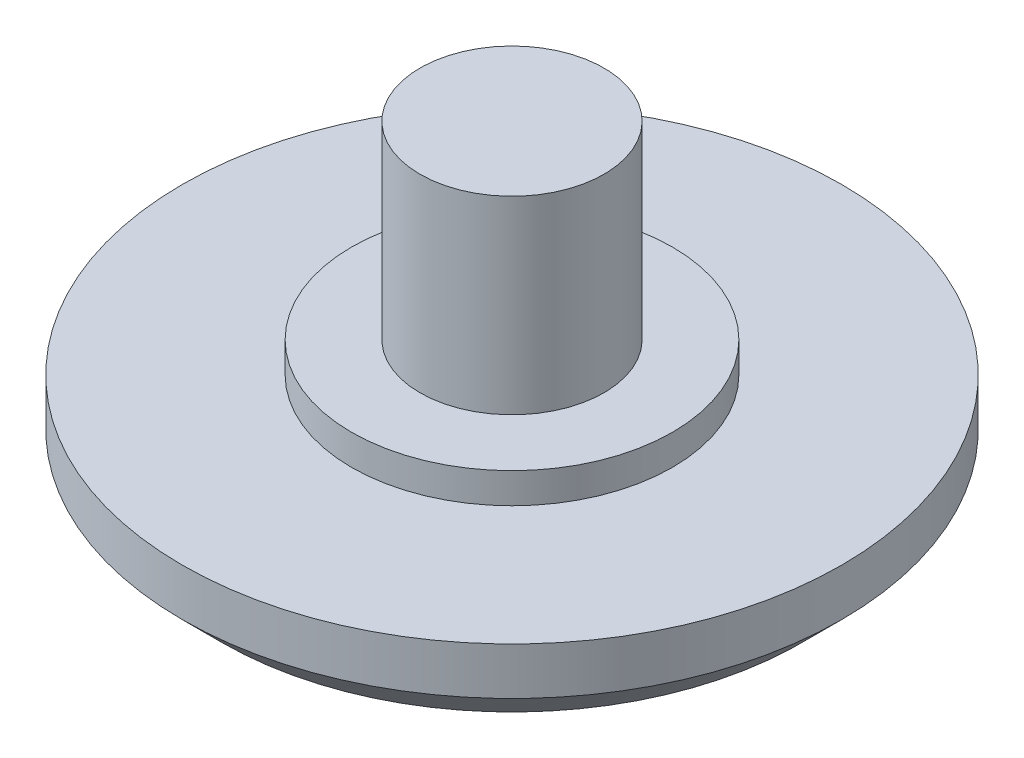
from build123d import *

# Parameters (mm, degrees)
SKETCH_3_R          = 8.24
EXTRUDE_5_DEPTH     = 2.18
SKETCH_7_R          = 4.01
EXTRUDE_6_DEPTH     = 1.36
SKETCH_8_R          = 2.42
EXTRUDE_7_DEPTH     = 4.28
SKETCH_9_R          = 5.6
CUT_EXTRUDE_3_DEPTH = 0.4
CUT_EXTRUDE_START   = -0.6
SKETCH_12_R         = 4.01
SKETCH_12_R_2       = 2.42
CUT_EXTRUDE_5_DEPTH = 0.6
SKETCH_13_OUTSIDE_W = 23.396
SKETCH_13_OUTSIDE_H = 23.396
SKETCH_13_OUTSIDE_R = 2.3
CUT_EXTRUDE_6_DEPTH = 4.88
SKETCH_14_R         = 2.3
CUT_EXTRUDE_7_DEPTH = 0.15


with BuildPart() as part:
    # 草图3 → 凸台-拉伸5 (new body)
    with BuildSketch(Plane(origin=(0, 0, 0), x_dir=(1, 0, 0), z_dir=(0, 1, 0))):
        with Locations(Location((0, 0, 0), (0, 0, 270))):
            Circle(SKETCH_3_R)
    extrude(amount=EXTRUDE_5_DEPTH)

    # 草图7 → 凸台-拉伸6 (add)
    with BuildSketch(Plane(origin=(0, 2.18, 0), x_dir=(1, 0, 0), z_dir=(0, 1, 0))):
        with Locations(Location((0, 0, 0), (0, 0, 270))):
            Circle(SKETCH_7_R)
    extrude(amount=EXTRUDE_6_DEPTH)

    # 草图8 → 凸台-拉伸7 (add)
    with BuildSketch(Plane(origin=(0, 3.54, 0), x_dir=(1, 0, 0), z_dir=(0, 1, 0))):
        with Locations(Location((0, 0, 0), (0, 0, 270))):
            Circle(SKETCH_8_R)
    extrude(amount=EXTRUDE_7_DEPTH)

    # 草图9 → 切除-拉伸3 (cut)
    with BuildSketch(Plane.XZ):
        with Locations(Location((0, 0, 0), (0, 0, 270))):
            Circle(SKETCH_9_R)
    extrude(amount=-CUT_EXTRUDE_3_DEPTH, mode=Mode.SUBTRACT)

    # 草图10 → 切除-旋转1 (revolve, cut)
    with BuildSketch(Plane.XY, mode=Mode.PRIVATE) as cut_revolve_1_sk:
        Polygon((5.6, 0.4), (6.6, 0), (5.6, 0), align=None)
    revolve(cut_revolve_1_sk.sketch.rotate(Axis((0, 7.82, 0), (0, -1, 0)), 90), axis=Axis((0, 7.82, 0), (0, -1, 0)), mode=Mode.SUBTRACT)

    # 草图11 → 切除-旋转2 (revolve, cut)
    with BuildSketch(Plane.XY, mode=Mode.PRIVATE) as cut_revolve_2_sk:
        Polygon((8.24, 0), (8.24, 1), (7.24, 0), align=None)
    revolve(cut_revolve_2_sk.sketch.rotate(Axis((0, 2.18, 0), (0, -1, 0)), 90), axis=Axis((0, 2.18, 0), (0, -1, 0)), mode=Mode.SUBTRACT)

    # 草图12 → 切除-拉伸5 (cut)
    with BuildSketch(Plane(origin=(0, 3.54, 0), x_dir=(1, 0, 0), z_dir=(0, 1, 0)).offset(CUT_EXTRUDE_START)):
        with Locations(Location((0, 0, 0), (0, 0, 270))):
            Circle(SKETCH_12_R)
        with Locations(Location((0, 0, 0), (0, 0, 270))):
            Circle(SKETCH_12_R_2, mode=Mode.SUBTRACT)
    extrude(amount=CUT_EXTRUDE_5_DEPTH, mode=Mode.SUBTRACT)

    # 草图13 outside → 切除-拉伸6 (cut)
    with BuildSketch(Plane(origin=(0, 7.82, 0), x_dir=(1, 0, 0), z_dir=(0, 1, 0))):
        Rectangle(SKETCH_13_OUTSIDE_W, SKETCH_13_OUTSIDE_H)
        with Locations(Location((0, 0, 0), (0, 0, 270))):
            Circle(SKETCH_13_OUTSIDE_R, mode=Mode.SUBTRACT)
    extrude(amount=-CUT_EXTRUDE_6_DEPTH, mode=Mode.SUBTRACT)

    # 草图14 → 切除-拉伸7 (cut)
    with BuildSketch(Plane(origin=(0, 7.82, 0), x_dir=(1, 0, 0), z_dir=(0, 1, 0))):
        with Locations(Location((0, 0, 0), (0, 0, 270))):
            Circle(SKETCH_14_R)
    extrude(amount=-CUT_EXTRUDE_7_DEPTH, mode=Mode.SUBTRACT)


solid = part.part
